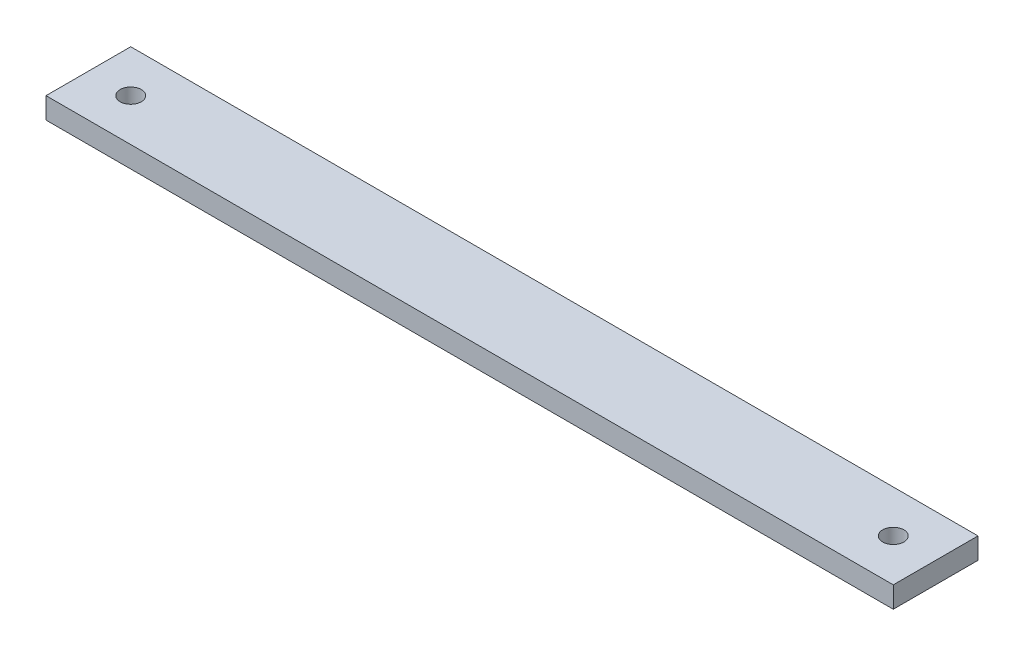
from build123d import *

# Parameters (mm, degrees)
SKETCH1_W                   = 254
SKETCH1_H                   = 25.4
BOSS_EXTRUDE1_DEPTH         = 6.35
F_1_4_0_25_DIAMETER_HOLE1_D = 6.35


with BuildPart() as part:
    # Sketch1 → Boss-Extrude1 (new body)
    with BuildSketch(Plane(origin=(0, 0, 0), x_dir=(1, 0, 0), z_dir=(0, 1, 0))):
        with Locations((-127, 12.7)):
            Rectangle(SKETCH1_W, SKETCH1_H)
    extrude(amount=BOSS_EXTRUDE1_DEPTH)

    # 1/4 (0.25) Diameter Hole1 (through all)
    with Locations(Plane(origin=(0, 0, 0), x_dir=(-1, 0, 0), z_dir=(0, -1, 0))):
        with Locations((241.3, 12.7), (12.7, 12.7)):
            Hole(F_1_4_0_25_DIAMETER_HOLE1_D / 2)


solid = part.part
